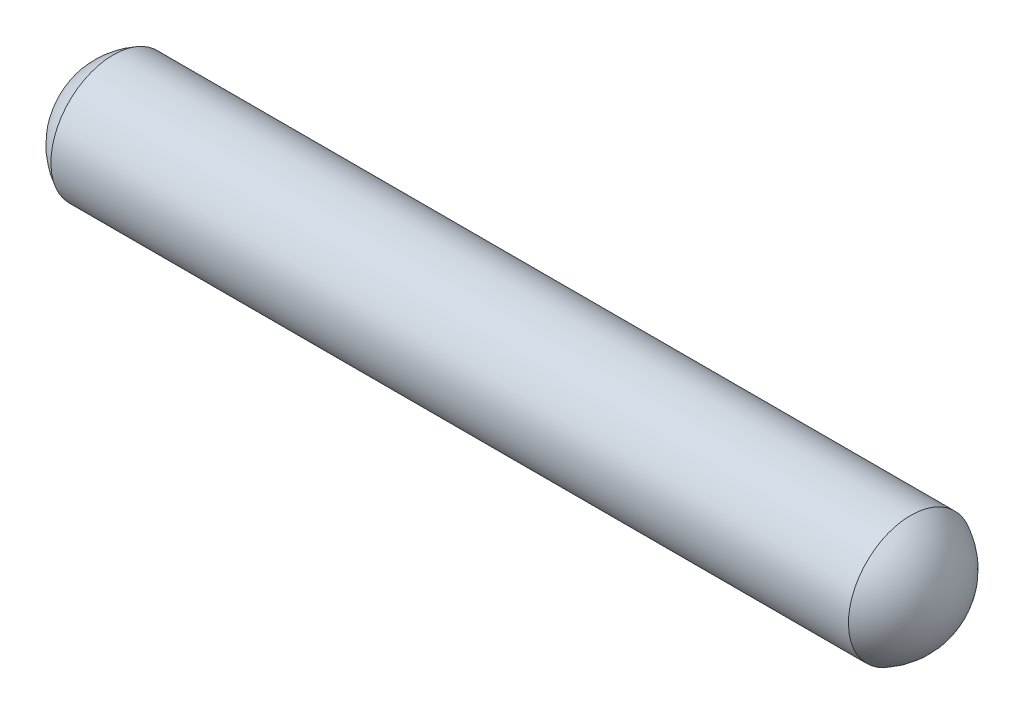
from build123d import *


with BuildPart() as part:
    # Esquisse1 → Révolution1 (revolve)
    with BuildSketch(Plane.XY):
        with BuildLine():
            Line((-16, 2.5), (0, 2.5))
            Line((0, 2.5), (0, 0))
            Line((0, 0), (-17.545084972, 0))
            ThreePointArc((-17.545084972, 0), (-17.127641291, 1.469463131), (-16, 2.5))
        make_face()
    r_volution1 = revolve(axis=Axis((0, 0, 0), (-1, 0, 0)))

    # Symétrie2: Révolution1 across plane
    add(r_volution1.mirror(Plane(origin=(0, 2.5, 0), x_dir=(0, 0, 1), z_dir=(1, 0, 0))))


solid = part.part
